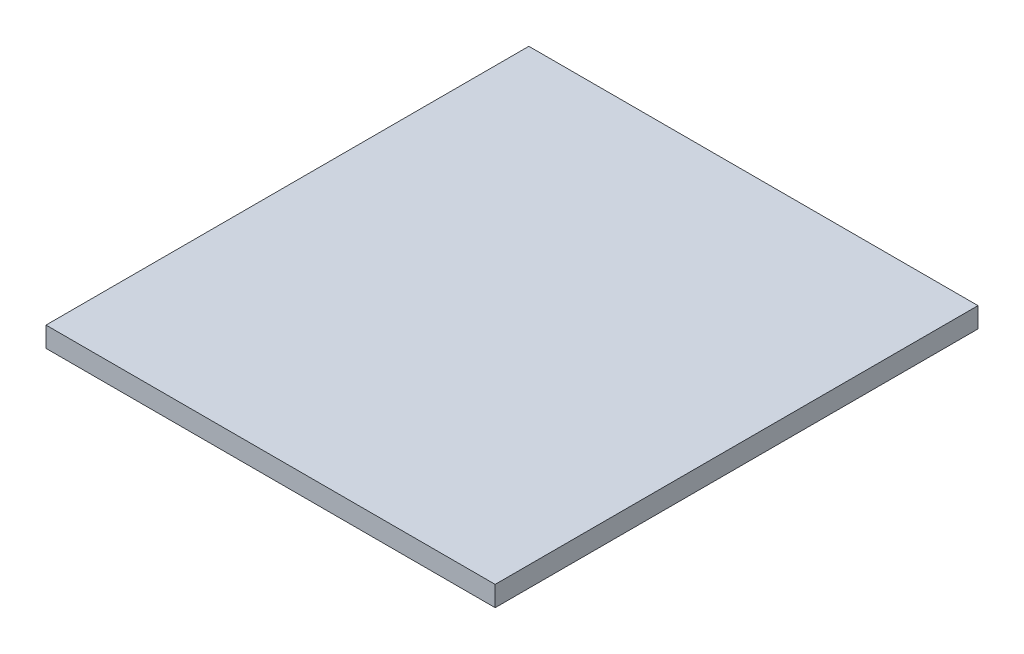
from build123d import *

# Parameters (mm, degrees)
SKDOBSONBASEINFERIOR_W   = 400
SKDOBSONBASEINFERIOR_H   = 430
DOBSONBASEINFERIOR_DEPTH = 18


with BuildPart() as part:
    # SkDobsonBaseInferior → DobsonBaseInferior (new body)
    with BuildSketch(Plane(origin=(0, 0, 0), x_dir=(1, 0, 0), z_dir=(0, 1, 0))):
        Rectangle(SKDOBSONBASEINFERIOR_W, SKDOBSONBASEINFERIOR_H)
    extrude(amount=DOBSONBASEINFERIOR_DEPTH)


solid = part.part
